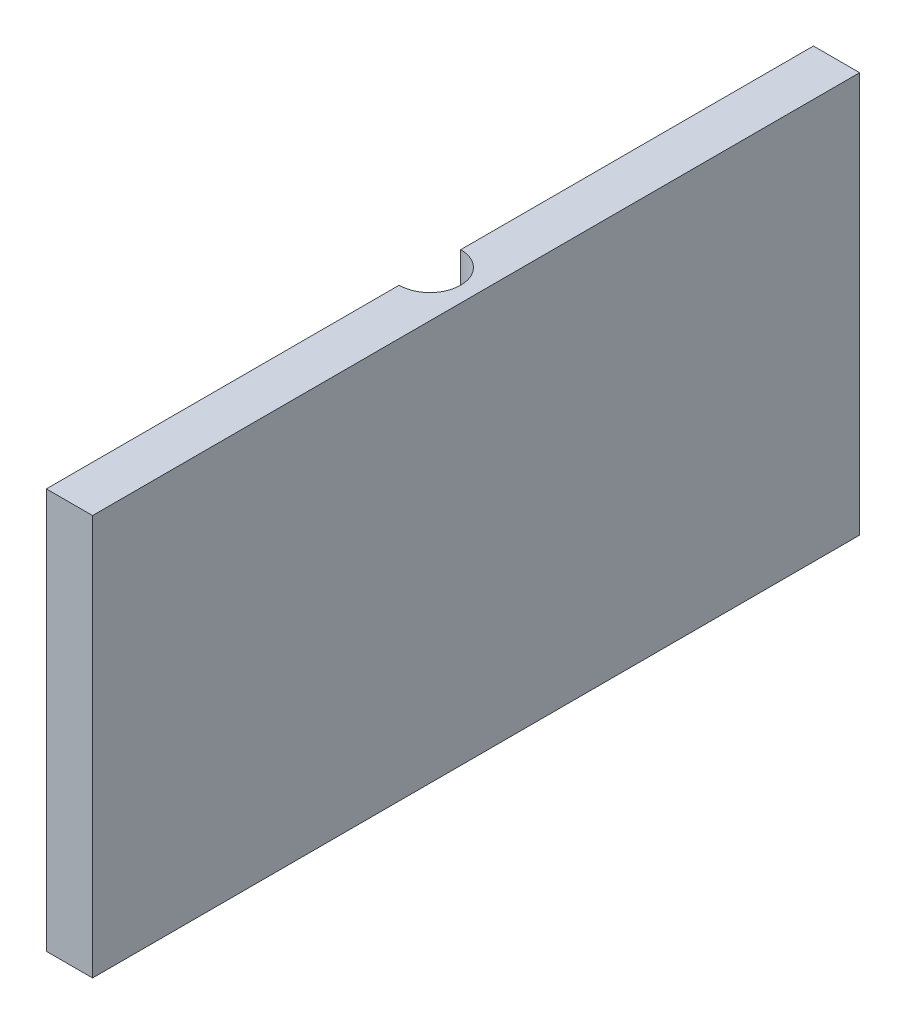
from build123d import *

# Parameters (mm, degrees)
SZKIC1_W                    = 15
SZKIC1_H                    = 249
DODANIE_WYCI_GNI_CIE1_DEPTH = 130
SZKIC2_R                    = 10
WYTNIJ_WYCI_GNI_CIE1_DEPTH  = 50


with BuildPart() as part:
    # Szkic1 → Dodanie-wyciągnięcie1 (new body)
    with BuildSketch(Plane(origin=(0, 0, 0), x_dir=(1, 0, 0), z_dir=(0, 1, 0))):
        Rectangle(SZKIC1_W, SZKIC1_H)
    extrude(amount=DODANIE_WYCI_GNI_CIE1_DEPTH)

    # Szkic2 → Wytnij-wyciągnięcie1 (cut)
    with BuildSketch(Plane(origin=(0, 130, 0), x_dir=(1, 0, 0), z_dir=(0, 1, 0))):
        with Locations((-7.5, 0)):
            Circle(SZKIC2_R)
    extrude(amount=-WYTNIJ_WYCI_GNI_CIE1_DEPTH, mode=Mode.SUBTRACT)


solid = part.part
